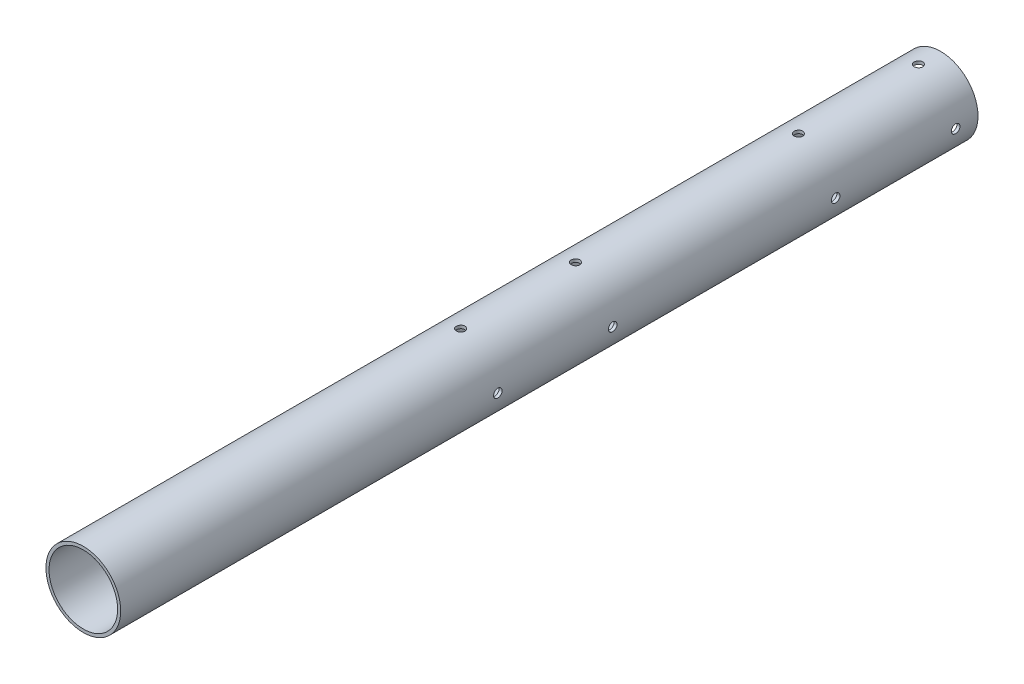
from build123d import *

# Parameters (mm, degrees)
SKETCH2_R            = 27.686
SKETCH2_R_2          = 25.4
TUBE_EXTRUDE_DEPTH   = 635
BOLTHOLES_REACH      = 640.011
BOLTHOLES_END_RADIUS = 25.4
SKETCH4_R            = 3.175
CIRPATTERN2_COUNT    = 4


with BuildPart() as part:
    # Sketch2 → tube_extrude (new body)
    with BuildSketch(Plane(origin=(0, 0, 0), x_dir=(0, 1, 0), z_dir=(0, 0, 1))):
        with Locations(Location((0, 0, 0), (0, 0, 90))):
            Circle(SKETCH2_R)
        with Locations(Location((0, 0, 0), (0, 0, 90))):
            Circle(SKETCH2_R_2, mode=Mode.SUBTRACT)
    extrude(amount=TUBE_EXTRUDE_DEPTH)

    # boltholes: up to this cylinder (the profile starts outside it)
    boltholes_end = Plane(origin=(0, 0, 186.055), z_dir=(0, 0, -1)) * Cylinder(BOLTHOLES_END_RADIUS, 1670.912, mode=Mode.PRIVATE)
    # Sketch4 → boltholes (cut, up to the surface)
    with BuildSketch(Plane.ZY.offset(27.686), mode=Mode.PRIVATE) as boltholes_sk1:
        with Locations(Location((355.6, 0, 0), (0, 0, 270))):
            Circle(SKETCH4_R)
    boltholes_tool1 = extrude(boltholes_sk1.sketch, amount=-BOLTHOLES_REACH, mode=Mode.PRIVATE) - boltholes_end
    # Sketch4 → boltholes (cut, up to the surface)
    with BuildSketch(Plane.ZY.offset(27.686), mode=Mode.PRIVATE) as boltholes_sk2:
        with Locations(Location((270.51, 0, 0), (0, 0, 270))):
            Circle(SKETCH4_R)
    boltholes_tool2 = extrude(boltholes_sk2.sketch, amount=-BOLTHOLES_REACH, mode=Mode.PRIVATE) - boltholes_end
    # Sketch4 → boltholes (cut, up to the surface)
    with BuildSketch(Plane.ZY.offset(27.686), mode=Mode.PRIVATE) as boltholes_sk3:
        with Locations(Location((105.41, 0, 0), (0, 0, 270))):
            Circle(SKETCH4_R)
    boltholes_tool3 = extrude(boltholes_sk3.sketch, amount=-BOLTHOLES_REACH, mode=Mode.PRIVATE) - boltholes_end
    # Sketch4 → boltholes (cut, up to the surface)
    with BuildSketch(Plane.ZY.offset(27.686), mode=Mode.PRIVATE) as boltholes_sk4:
        with Locations(Location((16.51, 0, 0), (0, 0, 270))):
            Circle(SKETCH4_R)
    boltholes_tool4 = extrude(boltholes_sk4.sketch, amount=-BOLTHOLES_REACH, mode=Mode.PRIVATE) - boltholes_end
    boltholes = boltholes_tool1.solids().sort_by_distance((-27.686, 0, 355.6))[0] + boltholes_tool2.solids().sort_by_distance((-27.686, 0, 270.51))[0] + boltholes_tool3.solids().sort_by_distance((-27.686, 0, 105.41))[0] + boltholes_tool4.solids().sort_by_distance((-27.686, 0, 16.51))[0]
    add(boltholes, mode=Mode.SUBTRACT)

    # CirPattern2: boltholes ×4 about axis
    cirpattern2_axis = Axis((0, 0, 635), (0, 0, -1))
    for i in range(1, CIRPATTERN2_COUNT):
        add(boltholes.rotate(cirpattern2_axis, i * 360 / CIRPATTERN2_COUNT), mode=Mode.SUBTRACT)


solid = part.part
